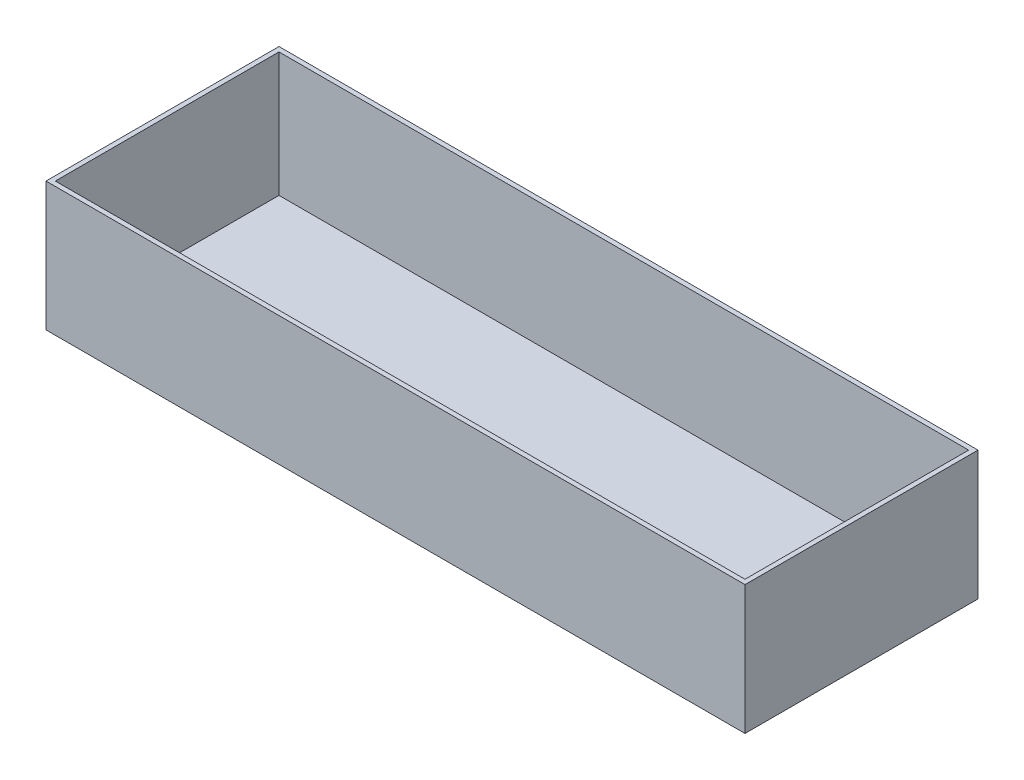
from build123d import *

# Parameters (mm, degrees)
SKETCH1_W           = 180
SKETCH1_H           = 60
BOSS_EXTRUDE1_DEPTH = 1.2
SKETCH3_W           = 180
SKETCH3_H           = 60
SKETCH3_W_2         = 177.6
SKETCH3_H_2         = 57.6
BOSS_EXTRUDE2_DEPTH = 32
SKETCH4_W           = 40
SKETCH4_H           = 0.8
BOSS_EXTRUDE3_DEPTH = 10


with BuildPart() as part:
    # Sketch1 → Boss-Extrude1 (new body)
    with BuildSketch(Plane(origin=(0, 0, 0), x_dir=(1, 0, 0), z_dir=(0, 1, 0))):
        with Locations((90, 30)):
            Rectangle(SKETCH1_W, SKETCH1_H)
    extrude(amount=BOSS_EXTRUDE1_DEPTH)

    # Sketch3 → Boss-Extrude2 (add)
    with BuildSketch(Plane(origin=(0, 1.2, 0), x_dir=(1, 0, 0), z_dir=(0, 1, 0))):
        with Locations((90, 30)):
            Rectangle(SKETCH3_W, SKETCH3_H)
        with Locations((90, 30)):
            Rectangle(SKETCH3_W_2, SKETCH3_H_2, mode=Mode.SUBTRACT)
    extrude(amount=BOSS_EXTRUDE2_DEPTH)

    # Sketch4 → Boss-Extrude3 (add)
    with BuildSketch(Plane(origin=(0, 1.2, 0), x_dir=(1, 0, 0), z_dir=(0, 1, 0))):
        with Locations((36.2, 7.9)):
            Rectangle(SKETCH4_W, SKETCH4_H)
    extrude(amount=BOSS_EXTRUDE3_DEPTH)


solid = part.part
